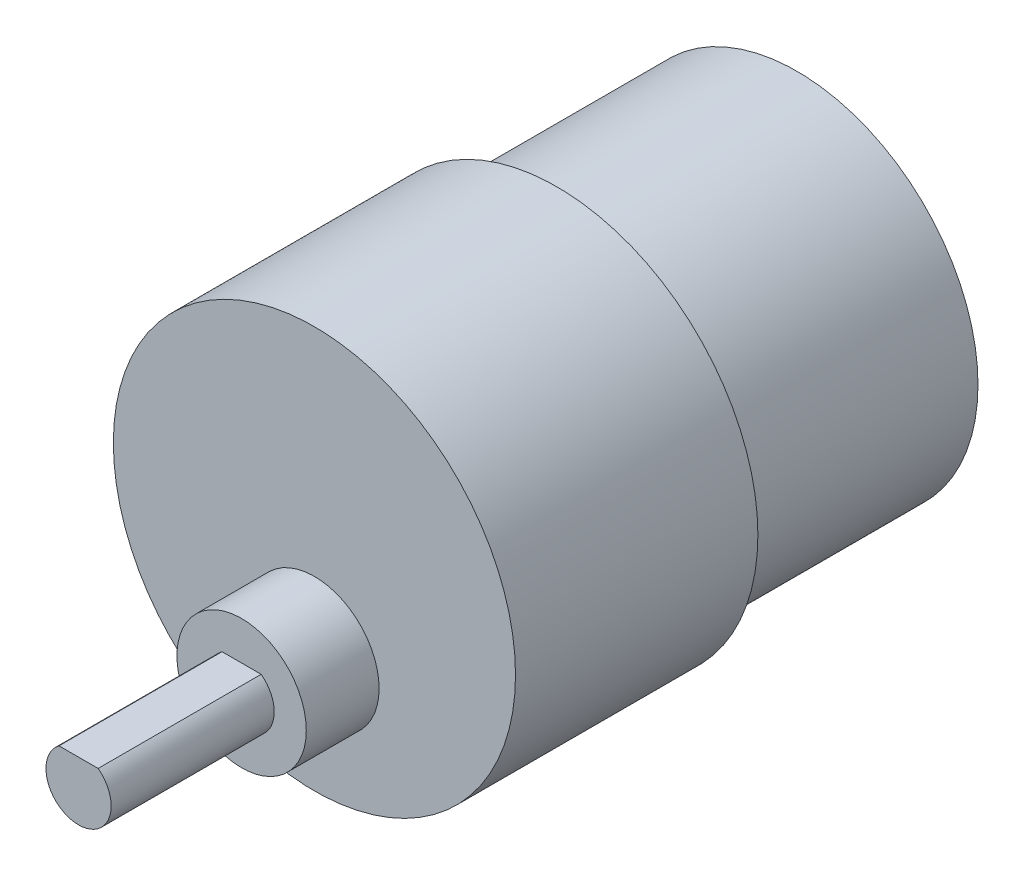
from build123d import *

# Parameters (mm, degrees)
CROQUIS1_R              = 16.65
SALIENTE_EXTRUIR1_DEPTH = 22.1
CROQUIS2_R              = 18.5
SALIENTE_EXTRUIR3_DEPTH = 22.3
CROQUIS3_R              = 5.95
SALIENTE_EXTRUIR4_DEPTH = 6.7
SALIENTE_EXTRUIR5_DEPTH = 15


with BuildPart() as part:
    # Croquis1 → Saliente-Extruir1 (new body)
    with BuildSketch(Plane.XY):
        Circle(CROQUIS1_R)
    extrude(amount=SALIENTE_EXTRUIR1_DEPTH)

    # Croquis2 → Saliente-Extruir3 (add)
    with BuildSketch(Plane.XY.offset(22.1)):
        Circle(CROQUIS2_R)
    extrude(amount=SALIENTE_EXTRUIR3_DEPTH)

    # Croquis3 → Saliente-Extruir4 (add)
    with BuildSketch(Plane.XY.offset(44.4)):
        with Locations((0, -7.35)):
            Circle(CROQUIS3_R)
    extrude(amount=SALIENTE_EXTRUIR4_DEPTH)

    # Croquis4 → Saliente-Extruir5 (add)
    with BuildSketch(Plane.XY.offset(51.1)):
        with BuildLine():
            Line((-1.8, -4.95), (1.8, -4.95))
            ThreePointArc((1.8, -4.95), (0, -10.35), (-1.8, -4.95))
        make_face()
    extrude(amount=SALIENTE_EXTRUIR5_DEPTH)


solid = part.part
